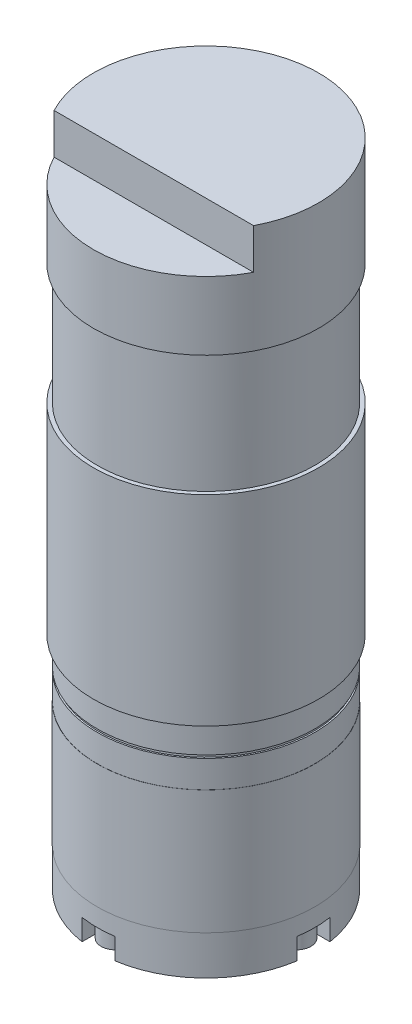
from build123d import *

# Parameters (mm, degrees)
SKETCH1_R           = 18
BOSS_EXTRUDE1_DEPTH = 89.8
SKETCH2_R           = 18.65
BOSS_EXTRUDE2_DEPTH = 18
BOSS_EXTRUDE4_DEPTH = 1.3
BOSS_EXTRUDE3_START = 33.2
SKETCH3_R           = 18.65
BOSS_EXTRUDE3_DEPTH = 33.2
SKETCH11_R          = 4
CUT_EXTRUDE1_DEPTH  = 10.3
CUT_EXTRUDE2_START  = -6.7
CUT_EXTRUDE2_DEPTH  = 6.7
SKETCH14_R          = 1.5
CUT_EXTRUDE3_DEPTH  = 10
SKETCH16_R          = 18.025
BOSS_EXTRUDE5_DEPTH = 20.5
SKETCH17_R          = 19.645678417
SKETCH17_R_2        = 17.75
CUT_EXTRUDE5_DEPTH  = 0.5
CUT_EXTRUDE6_DEPTH  = 3.5
SKETCH19_R          = 2.375
BOSS_EXTRUDE6_DEPTH = 3
CUT_EXTRUDE7_DEPTH  = 3


with BuildPart() as part:
    # Sketch1 → Boss-Extrude1 (new body)
    with BuildSketch(Plane(origin=(0, 0, 0), x_dir=(1, 0, 0), z_dir=(0, 1, 0))):
        with Locations(Location((0, 0, 0), (0, 0, 270))):
            Circle(SKETCH1_R)
    extrude(amount=BOSS_EXTRUDE1_DEPTH)

    # Sketch2 → Boss-Extrude2 (add)
    with BuildSketch(Plane(origin=(0, 89.8, 0), x_dir=(1, 0, 0), z_dir=(0, 1, 0))):
        with Locations(Location((0, 0, 0), (0, 0, 270))):
            Circle(SKETCH2_R)
    extrude(amount=BOSS_EXTRUDE2_DEPTH)

    # Sketch9 → Boss-Extrude4 (add)
    with BuildSketch(Plane.XZ):
        with BuildLine():
            Line((4.582575695, -10), (-4.582575695, -10))
            ThreePointArc((-4.582575695, -10), (-11, 0), (-4.582575695, 10))
            Line((-4.582575695, 10), (4.582575695, 10))
            ThreePointArc((4.582575695, 10), (11, 0), (4.582575695, -10))
        make_face()
    extrude(amount=BOSS_EXTRUDE4_DEPTH)

    # Sketch3 → Boss-Extrude3 (add)
    with BuildSketch(Plane(origin=(0, 69.8, 0), x_dir=(-1, 0, 0), z_dir=(0, -1, 0)).offset(BOSS_EXTRUDE3_START)):
        with Locations(Location((0, 0, 0), (0, 0, 270))):
            Circle(SKETCH3_R)
    extrude(amount=-BOSS_EXTRUDE3_DEPTH)

    # Sketch11 → Cut-Extrude1 (cut)
    with BuildSketch(Plane.XZ.offset(1.3)):
        with Locations(Location((0, 0, 0), (0, 0, 270))):
            Circle(SKETCH11_R)
    extrude(amount=-CUT_EXTRUDE1_DEPTH, mode=Mode.SUBTRACT)

    # Sketch13 → Cut-Extrude2 (cut)
    with BuildSketch(Plane(origin=(0, 107.8, 0), x_dir=(1, 0, 0), z_dir=(0, 1, 0)).offset(CUT_EXTRUDE2_START)):
        with BuildLine():
            Line((-16.522711642, -8.65), (16.522711642, -8.65))
            ThreePointArc((16.522711642, -8.65), (0, -18.65), (-16.522711642, -8.65))
        make_face()
    extrude(amount=CUT_EXTRUDE2_DEPTH, mode=Mode.SUBTRACT)

    # Sketch14 → Cut-Extrude3 (cut)
    with BuildSketch(Plane.XZ):
        with Locations(Location((-9.899494937, 9.899494937, 0), (0, 0, 270))):
            Circle(SKETCH14_R)
        with Locations(Location((9.899494937, 9.899494937, 0), (0, 0, 270))):
            Circle(SKETCH14_R)
        with Locations(Location((9.899494937, -9.899494937, 0), (0, 0, 270))):
            Circle(SKETCH14_R)
        with Locations(Location((-9.899494937, -9.899494937, 0), (0, 0, 270))):
            Circle(SKETCH14_R)
    extrude(amount=-CUT_EXTRUDE3_DEPTH, mode=Mode.SUBTRACT)

    # Sketch16 → Boss-Extrude5 (add)
    with BuildSketch(Plane(origin=(0, 6.5, 0), x_dir=(-1, 0, 0), z_dir=(0, -1, 0))):
        with Locations(Location((0, 0, 0), (0, 0, 90))):
            Circle(SKETCH16_R)
    extrude(amount=-BOSS_EXTRUDE5_DEPTH)

    # Sketch17 → Cut-Extrude5 (cut)
    with BuildSketch(Plane(origin=(0, 31.5, 0), x_dir=(-1, 0, 0), z_dir=(0, -1, 0))):
        Circle(SKETCH17_R)
        with Locations(Location((0, 0, 0), (0, 0, 90))):
            Circle(SKETCH17_R_2, mode=Mode.SUBTRACT)
    extrude(amount=-CUT_EXTRUDE5_DEPTH, mode=Mode.SUBTRACT)

    # Sketch18 → Cut-Extrude6 (cut)
    with BuildSketch(Plane.XZ):
        with BuildLine():
            Line((2.75, -15), (2.75, -20))
            Line((2.75, -20), (-2.75, -20))
            Line((-2.75, -20), (-2.75, -15))
            ThreePointArc((-2.75, -15), (0, -12.25), (2.75, -15))
        make_face()
        with BuildLine():
            Line((2.75, 15), (2.75, 20))
            Line((2.75, 20), (-2.75, 20))
            Line((-2.75, 20), (-2.75, 15))
            ThreePointArc((-2.75, 15), (0, 12.25), (2.75, 15))
        make_face()
        with BuildLine():
            Line((-15, 2.75), (-20, 2.75))
            Line((-20, 2.75), (-20, -2.75))
            Line((-20, -2.75), (-15, -2.75))
            ThreePointArc((-15, -2.75), (-12.25, 0), (-15, 2.75))
        make_face()
        with BuildLine():
            Line((15, -2.75), (20, -2.75))
            Line((20, -2.75), (20, 2.75))
            Line((20, 2.75), (15, 2.75))
            ThreePointArc((15, 2.75), (12.25, 0), (15, -2.75))
        make_face()
    extrude(amount=-CUT_EXTRUDE6_DEPTH, mode=Mode.SUBTRACT)

    # Sketch19 → Boss-Extrude6 (add)
    with BuildSketch(Plane.XZ.offset(-3.5)):
        with Locations(Location((-15, 0, 0), (0, 0, 270))):
            Circle(SKETCH19_R)
        with Locations(Location((0, 15, 0), (0, 0, 270))):
            Circle(SKETCH19_R)
        with Locations(Location((15, 0, 0), (0, 0, 270))):
            Circle(SKETCH19_R)
        with Locations(Location((0, -15, 0), (0, 0, 270))):
            Circle(SKETCH19_R)
    extrude(amount=BOSS_EXTRUDE6_DEPTH)

    # Sketch20 → Cut-Extrude7 (cut)
    with BuildSketch(Plane.XZ.offset(-0.5)):
        Polygon((16.515813069, 0.875155083), (15, 1.750310167), (13.484186931, 0.875155083), (13.484186931, -0.875155083), (15, -1.750310167), (16.515813069, -0.875155083), align=None)
        Polygon((-1.750310167, 15), (-0.875155083, 13.484186931), (0.875155083, 13.484186931), (1.750310167, 15), (0.875155083, 16.515813069), (-0.875155083, 16.515813069), align=None)
        Polygon((0.875155083, -16.515813069), (1.750310167, -15), (0.875155083, -13.484186931), (-0.875155083, -13.484186931), (-1.750310167, -15), (-0.875155083, -16.515813069), align=None)
        Polygon((-16.515813069, -0.875155083), (-15, -1.750310167), (-13.484186931, -0.875155083), (-13.484186931, 0.875155083), (-15, 1.750310167), (-16.515813069, 0.875155083), align=None)
    extrude(amount=-CUT_EXTRUDE7_DEPTH, mode=Mode.SUBTRACT)


solid = part.part
